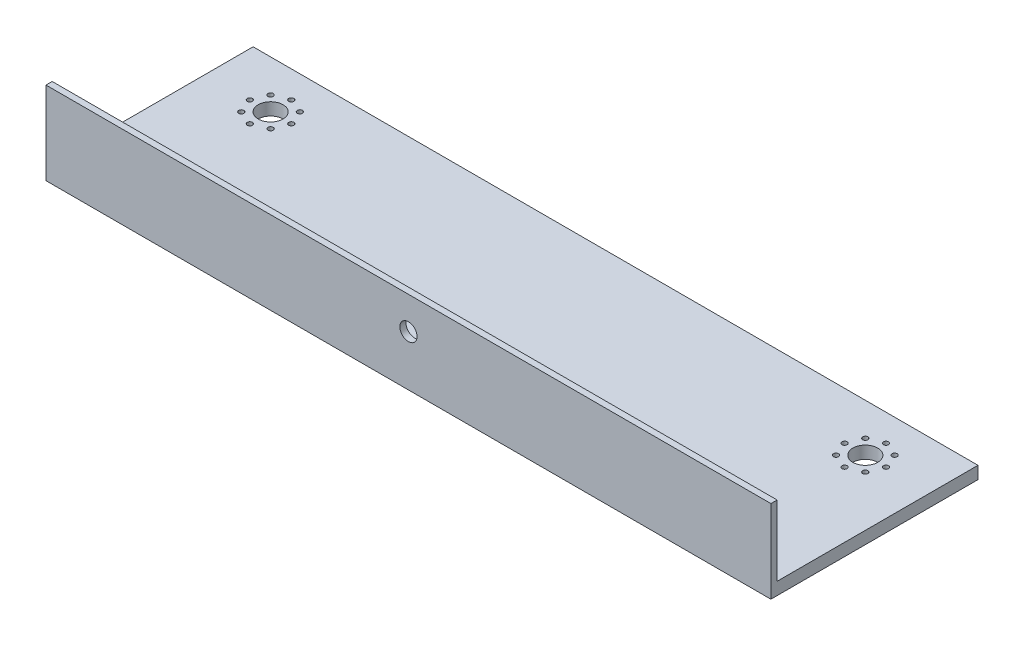
from build123d import *

# Parameters (mm, degrees)
SKETCH1_W           = 350
SKETCH1_H           = 100
SKETCH1_R           = 6
BOSS_EXTRUDE1_DEPTH = 3
SKETCH2_W           = 350
SKETCH2_H           = 40
BOSS_EXTRUDE2_DEPTH = 3
SKETCH3_R           = 4.15
CUT_EXTRUDE1_DEPTH  = 205.924376295
SKETCH4_R           = 1.25
CUT_EXTRUDE2_DEPTH  = 186.151289491


with BuildPart() as part:
    # Sketch1 → Boss-Extrude1 (new, symmetric)
    with BuildSketch(Plane(origin=(0, 0, 0), x_dir=(1, 0, 0), z_dir=(0, 1, 0))):
        Rectangle(SKETCH1_W, SKETCH1_H)
        with Locations(Location((143.57, 27.01502743, 0), (0, 0, 270))):
            Circle(SKETCH1_R, mode=Mode.SUBTRACT)
        with Locations(Location((-143.57, 27.01502743, 0), (0, 0, 270))):
            Circle(SKETCH1_R, mode=Mode.SUBTRACT)
    extrude(amount=BOSS_EXTRUDE1_DEPTH, both=True)

    # Sketch2 → Boss-Extrude2 (add)
    with BuildSketch(Plane.XY.offset(50)):
        with Locations((0, 17)):
            Rectangle(SKETCH2_W, SKETCH2_H)
    extrude(amount=-BOSS_EXTRUDE2_DEPTH)

    # Sketch3 → Cut-Extrude1 (cut, through all)
    with BuildSketch(Plane.XY.offset(50)):
        with Locations((0, 21.369646437)):
            Circle(SKETCH3_R)
    extrude(amount=-CUT_EXTRUDE1_DEPTH, mode=Mode.SUBTRACT)

    # Sketch4 → Cut-Extrude2 (cut, through all)
    with BuildSketch(Plane(origin=(0, 3, 0), x_dir=(1, 0, 0), z_dir=(0, 1, 0))):
        with Locations(Location((143.57, 37.01502743, 0), (0, 0, 270))):
            Circle(SKETCH4_R)
        with Locations(Location((153.57, 27.01502743, 0), (0, 0, 270))):
            Circle(SKETCH4_R)
        with Locations(Location((143.57, 17.01502743, 0), (0, 0, 270))):
            Circle(SKETCH4_R)
        with Locations(Location((133.57, 27.01502743, 0), (0, 0, 270))):
            Circle(SKETCH4_R)
        with Locations(Location((136.498932188, 34.086095242, 0), (0, 0, 270))):
            Circle(SKETCH4_R)
        with Locations(Location((150.641067812, 34.086095242, 0), (0, 0, 90))):
            Circle(SKETCH4_R)
        with Locations(Location((150.641067812, 19.943959618, 0), (0, 0, 270))):
            Circle(SKETCH4_R)
        with Locations(Location((136.498932188, 19.943959618, 0), (0, 0, 90))):
            Circle(SKETCH4_R)
    cut_extrude2 = extrude(amount=-CUT_EXTRUDE2_DEPTH, mode=Mode.SUBTRACT)

    # Mirror1: Cut-Extrude2 across plane
    add(cut_extrude2.mirror(Plane(origin=(0, 0, 0), x_dir=(0, 0, 1), z_dir=(1, 0, 0))), mode=Mode.SUBTRACT)


solid = part.part
